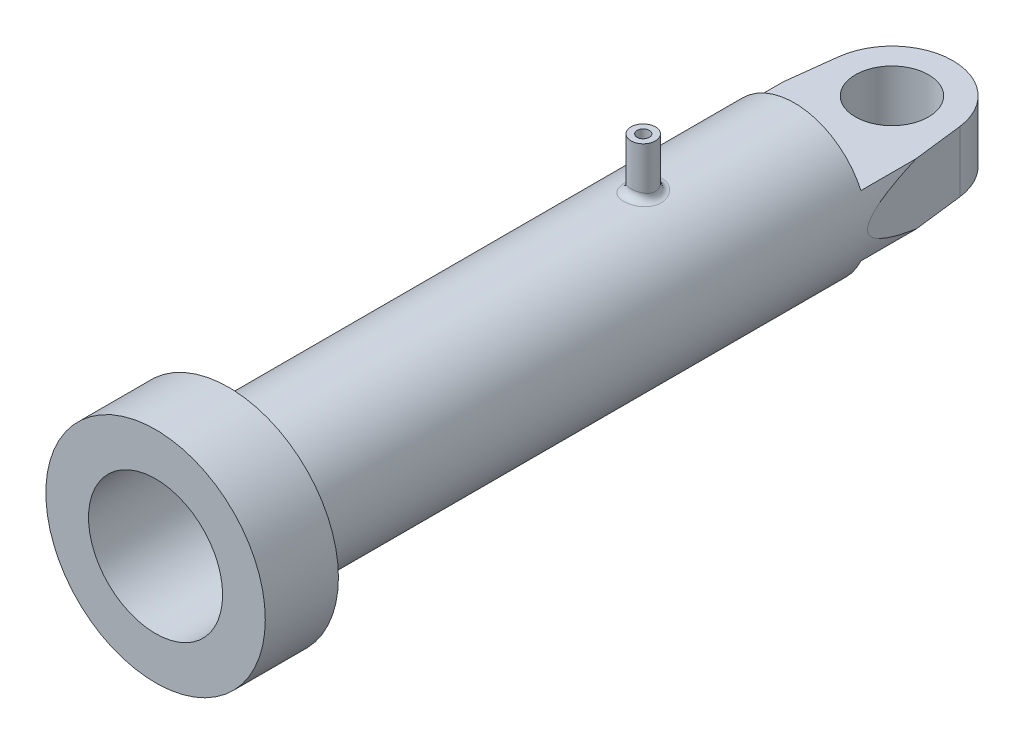
from build123d import *

# Parameters (mm, degrees)
SKETCH_1_R               = 4.5
EXTRUDE_1_DEPTH          = 3
SKETCH_2_R               = 3
EXTRUDE_2_DEPTH          = 26.2
SKETCH_6_R               = 1.5
EXTRUDE_3_DEPTH          = 1.25
SKETCH_8_OUTSIDE_W       = 18.018
SKETCH_8_OUTSIDE_H       = 18.018
SKETCH_8_OUTSIDE_R       = 3
CUT_EXTRUDE_3_DEPTH      = 31.374166655
SKETCH_4_R               = 2.75
CUT_EXTRUDE_1_DEPTH      = 22.2
FILLET_2_R               = 1
EXTRUDE_4_REACH          = 40.314
EXTRUDE_4_END_RADIUS     = 3
EXTRUDE_START            = 5
SKETCH_9_R               = 0.5
CUT_EXTRUDE_4_REACH      = 36.348
CUT_EXTRUDE_4_END_RADIUS = 2.75
SKETCH_10_R              = 0.25
FILLET_3_R               = 0.3


with BuildPart() as part:
    # 草圖1 → 填料-伸長1 (new body)
    with BuildSketch(Plane.XY):
        Circle(SKETCH_1_R)
    extrude(amount=-EXTRUDE_1_DEPTH)

    # 草圖2 → 填料-伸長2 (add)
    with BuildSketch(Plane.XY):
        Circle(SKETCH_2_R)
    extrude(amount=-EXTRUDE_2_DEPTH)

    # 草圖6 → 填料-伸長3 (add, symmetric)
    with BuildSketch(Plane(origin=(0, 0, 0), x_dir=(1, 0, 0), z_dir=(0, 1, 0))):
        with BuildLine():
            Line((-3, 26.2), (-2.482050808, 30.499038106))
            ThreePointArc((-2.482050808, 30.499038106), (0, 32.7), (2.482050808, 30.499038106))
            Line((2.482050808, 30.499038106), (3, 26.2))
            Line((3, 26.2), (-3, 26.2))
        make_face()
        with Locations(Location((0, 30.2, 0), (0, 0, 270))):
            Circle(SKETCH_6_R, mode=Mode.SUBTRACT)
    extrude(amount=EXTRUDE_3_DEPTH, both=True)

    # 草圖8 outside → 除料-伸長3 (cut, through all)
    with BuildSketch(Plane(origin=(0, 0, -3), x_dir=(-1, 0, 0), z_dir=(0, 0, -1))):
        Rectangle(SKETCH_8_OUTSIDE_W, SKETCH_8_OUTSIDE_H)
        with Locations(Location((0, 0, 0), (0, 0, 180))):
            Circle(SKETCH_8_OUTSIDE_R, mode=Mode.SUBTRACT)
    extrude(amount=CUT_EXTRUDE_3_DEPTH, mode=Mode.SUBTRACT)

    # 草圖4 → 除料-伸長1 (cut)
    with BuildSketch(Plane.XY):
        Circle(SKETCH_4_R)
    extrude(amount=-CUT_EXTRUDE_1_DEPTH, mode=Mode.SUBTRACT)

    # 圓角2
    fillet_2_edges = [part.edges().sort_by_distance(p)[0] for p in [
        (-2.75, 0, -22.2),
    ]]
    fillet(fillet_2_edges, radius=FILLET_2_R)

    # 填料-伸長4: up to this cylinder (the profile starts outside it)
    extrude_4_end = Plane(origin=(0, 0, -20), z_dir=(0, 0, 1)) * Cylinder(EXTRUDE_4_END_RADIUS, 87.628, mode=Mode.PRIVATE)
    # 草圖9 → 填料-伸長4 (add, up to the surface)
    with BuildSketch(Plane(origin=(0, 0, 0), x_dir=(1, 0, 0), z_dir=(0, 1, 0)).offset(EXTRUDE_START), mode=Mode.PRIVATE) as extrude_4_sk1:
        with Locations(Location((0, 20, 0), (0, 0, 270))):
            Circle(SKETCH_9_R)
    extrude_4_tool1 = extrude(extrude_4_sk1.sketch, amount=-EXTRUDE_4_REACH, mode=Mode.PRIVATE) - extrude_4_end
    add(extrude_4_tool1.solids().sort_by_distance((0, 5, -20))[0])

    # 除料-伸長4: up to this cylinder (the profile starts outside it)
    cut_extrude_4_end = Plane(origin=(0, 0, -20), z_dir=(0, 0, 1)) * Cylinder(CUT_EXTRUDE_4_END_RADIUS, 79.196, mode=Mode.PRIVATE)
    # 草圖10 → 除料-伸長4 (cut, up to the surface)
    with BuildSketch(Plane(origin=(0, 5, 0), x_dir=(1, 0, 0), z_dir=(0, 1, 0)), mode=Mode.PRIVATE) as cut_extrude_4_sk1:
        with Locations(Location((0, 20, 0), (0, 0, 270))):
            Circle(SKETCH_10_R)
    cut_extrude_4_tool1 = extrude(cut_extrude_4_sk1.sketch, amount=-CUT_EXTRUDE_4_REACH, mode=Mode.PRIVATE) - cut_extrude_4_end
    add(cut_extrude_4_tool1.solids().sort_by_distance((0, 5, -20))[0], mode=Mode.SUBTRACT)

    # 圓角3
    fillet_3_edges = [part.edges().sort_by_distance(p)[0] for p in [
        (0, 3, -20.5),
    ]]
    fillet(fillet_3_edges, radius=FILLET_3_R)


solid = part.part
